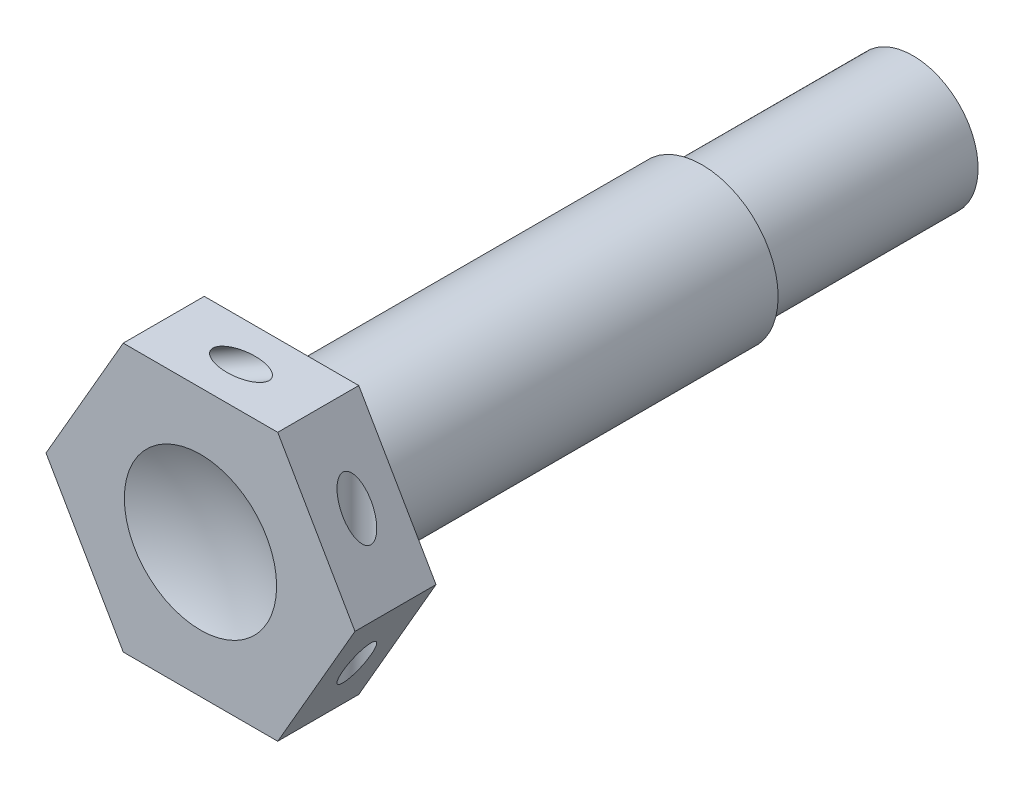
from build123d import *

# Parameters (mm, degrees)
BOSS_EXTRUDE1_DEPTH = 3.3655
SKETCH2_R           = 3.1623
BOSS_EXTRUDE2_DEPTH = 17.4625
SKETCH3_R           = 2.7051
BOSS_EXTRUDE3_DEPTH = 8.763
SKETCH5_R           = 0.5842
CUT_EXTRUDE1_DEPTH  = 28.564675155
CIRPATTERN1_COUNT   = 3


with BuildPart() as part:
    # Sketch1 → Boss-Extrude1 (new body)
    with BuildSketch(Plane.XY):
        Polygon((3.207902433, 5.55625), (-3.207902433, 5.55625), (-6.415804866, 0), (-3.207902433, -5.55625), (3.207902433, -5.55625), (6.415804866, 0), align=None)
    extrude(amount=BOSS_EXTRUDE1_DEPTH)

    # Sketch2 → Boss-Extrude2 (add)
    with BuildSketch(Plane(origin=(0, 0, 0), x_dir=(-1, 0, 0), z_dir=(0, 0, -1))):
        Circle(SKETCH2_R)
    extrude(amount=BOSS_EXTRUDE2_DEPTH)

    # Sketch3 → Boss-Extrude3 (add)
    with BuildSketch(Plane(origin=(0, 0, -17.4625), x_dir=(-1, 0, 0), z_dir=(0, 0, -1))):
        Circle(SKETCH3_R)
    extrude(amount=BOSS_EXTRUDE3_DEPTH)

    # Sketch4 → Cut-Revolve1 (revolve, cut)
    with BuildSketch(Plane(origin=(0, 0, 0), x_dir=(0, 0, -1), z_dir=(1, 0, 0))):
        with BuildLine():
            Line((-3.3655, 0), (-3.3655, 3.1623))
            ThreePointArc((-3.3655, 3.1623), (-2.841803396, 1.619539554), (-2.664434968, 0))
            Line((-2.664434968, 0), (-3.3655, 0))
        make_face()
    revolve(axis=Axis((0, 0, 3.3655), (0, 0, -1)), mode=Mode.SUBTRACT)

    # Sketch5 → Cut-Extrude1 (cut, symmetric)
    with BuildSketch(Plane(origin=(0, 0, 0), x_dir=(1, 0, 0), z_dir=(0, 1, 0))):
        with Locations((4.81185365, -1.68275)):
            Circle(SKETCH5_R)
    cut_extrude1 = extrude(amount=CUT_EXTRUDE1_DEPTH, both=True, mode=Mode.SUBTRACT)

    # CirPattern1: Cut-Extrude1 ×3 about axis
    cirpattern1_axis = Axis((0, 0, -27.70505), (0, 0, 1))
    for i in range(1, CIRPATTERN1_COUNT):
        add(cut_extrude1.rotate(cirpattern1_axis, i * 360 / CIRPATTERN1_COUNT), mode=Mode.SUBTRACT)


solid = part.part
